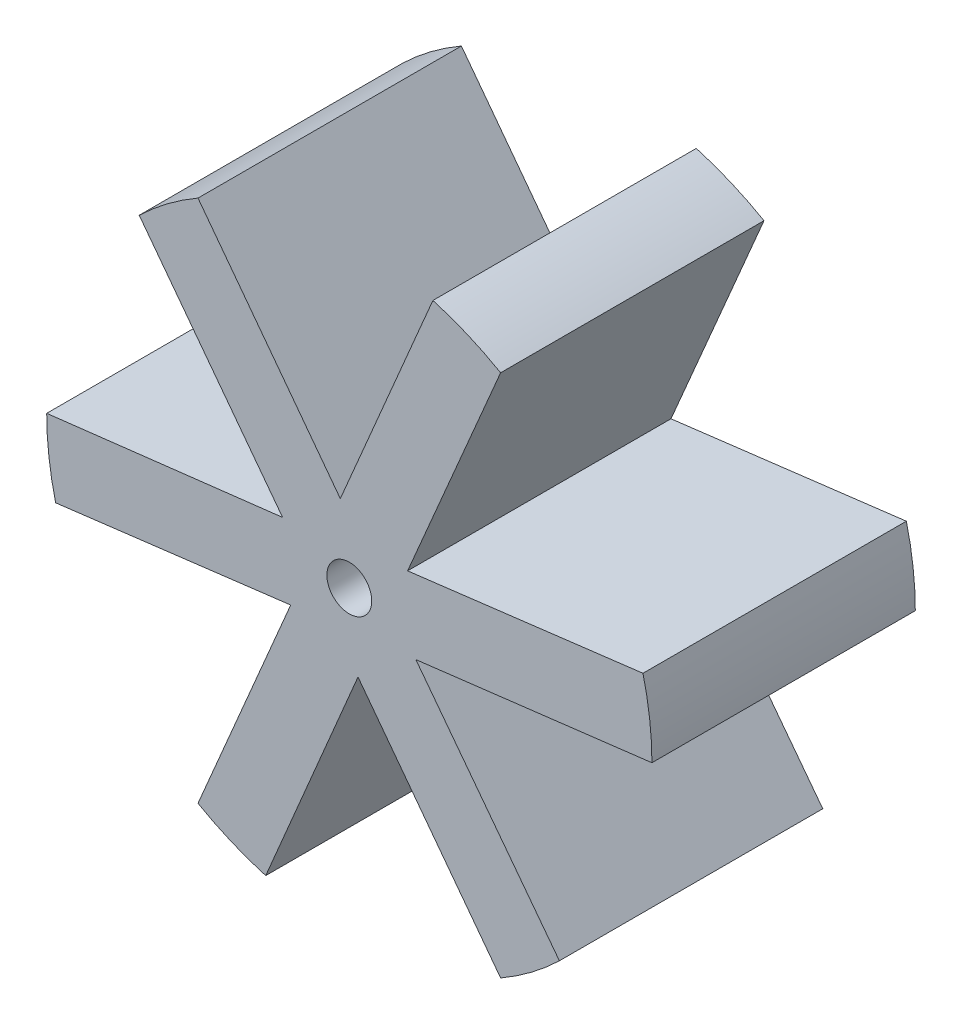
from build123d import *

# Parameters (mm, degrees)
EXTRUDE_1_DEPTH          = 23.5
CUT_EXTRUDE_1_DEPTH      = 45.211198656
CUT_EXTRUDE_1_DEPTH_BACK = 45.211198656
SKETCH_2_R               = 2


with BuildPart() as part:
    # 草图1 → 凸台-拉伸1 (new body)
    with BuildSketch(Plane.XY):
        with BuildLine():
            Line((-18.74404726, 19.433494084), (-5.953134221, 2.483458779))
            Line((-5.953134221, 2.483458779), (-27, 0))
            ThreePointArc((-27, 0), (-26.799738116, -3.282382812), (-26.201923191, -6.516074055))
            Line((-26.201923191, -6.516074055), (-5.228535388, -3.928299208))
            Line((-5.228535388, -3.928299208), (-13.5, -23.382685902))
            ThreePointArc((-13.5, -23.382685902), (-10.557242158, -24.850445429), (-7.457875931, -25.949568139))
            Line((-7.457875931, -25.949568139), (0.77550929, -6.485913341))
            Line((0.77550929, -6.485913341), (13.5, -23.382685902))
            ThreePointArc((13.5, -23.382685902), (16.242495958, -21.568062617), (18.74404726, -19.433494084))
            Line((18.74404726, -19.433494084), (5.938212824, -2.560395934))
            Line((5.938212824, -2.560395934), (27, 0))
            ThreePointArc((27, 0), (26.799738116, 3.282382812), (26.201923191, 6.516074055))
            Line((26.201923191, 6.516074055), (5.200951411, 3.927966656))
            Line((5.200951411, 3.927966656), (13.5, 23.382685902))
            ThreePointArc((13.5, 23.382685902), (10.557242158, 24.850445429), (7.457875931, 25.949568139))
            Line((7.457875931, 25.949568139), (-0.802395418, 6.505702023))
            Line((-0.802395418, 6.505702023), (-13.5, 23.382685902))
            ThreePointArc((-13.5, 23.382685902), (-16.242495958, 21.568062617), (-18.74404726, 19.433494084))
        make_face()
    extrude(amount=EXTRUDE_1_DEPTH)

    # 草图2 → 切除-拉伸1 (cut, two sides: drawn at the far end of the back side and taken through both)
    with BuildSketch(Plane.XY.offset(23.5).offset(-CUT_EXTRUDE_1_DEPTH_BACK)):
        Circle(SKETCH_2_R)
    extrude(amount=CUT_EXTRUDE_1_DEPTH + CUT_EXTRUDE_1_DEPTH_BACK, mode=Mode.SUBTRACT)


solid = part.part
